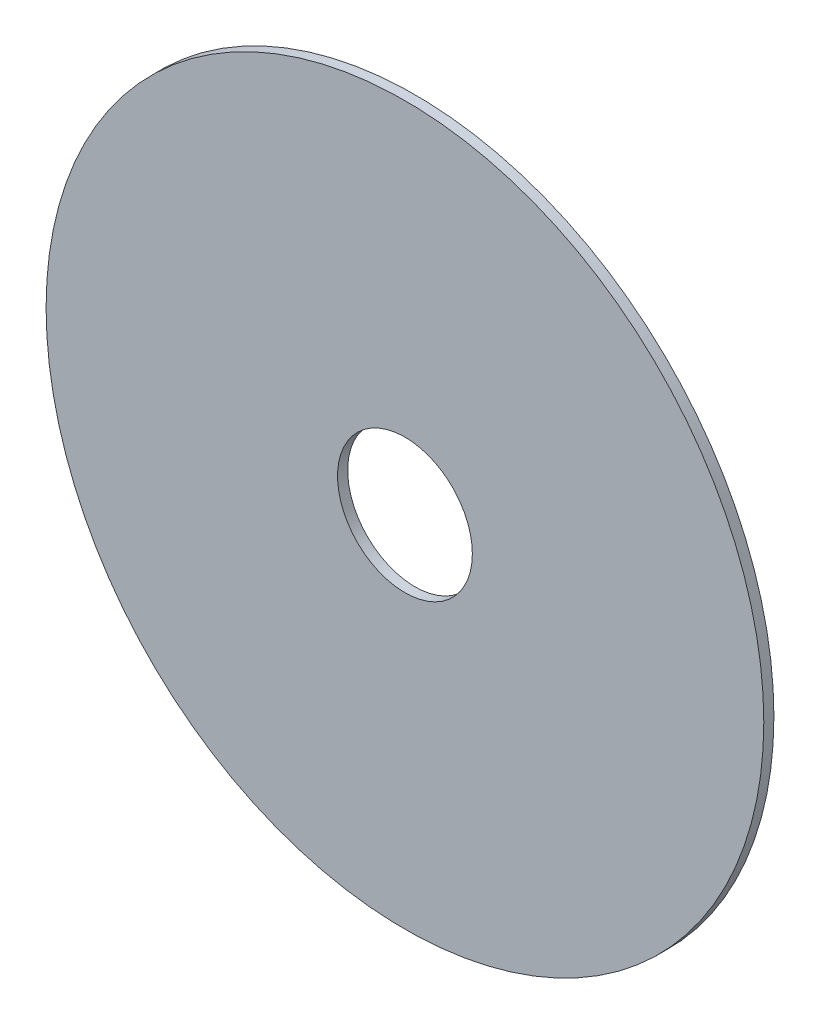
from build123d import *

# Parameters (mm, degrees)
CROQUIS1_R              = 106.5
CROQUIS1_R_2            = 20
SALIENTE_EXTRUIR1_DEPTH = 3


with BuildPart() as part:
    # Croquis1 → Saliente-Extruir1 (new body)
    with BuildSketch(Plane.XY):
        Circle(CROQUIS1_R)
        Circle(CROQUIS1_R_2, mode=Mode.SUBTRACT)
    extrude(amount=SALIENTE_EXTRUIR1_DEPTH)


solid = part.part
